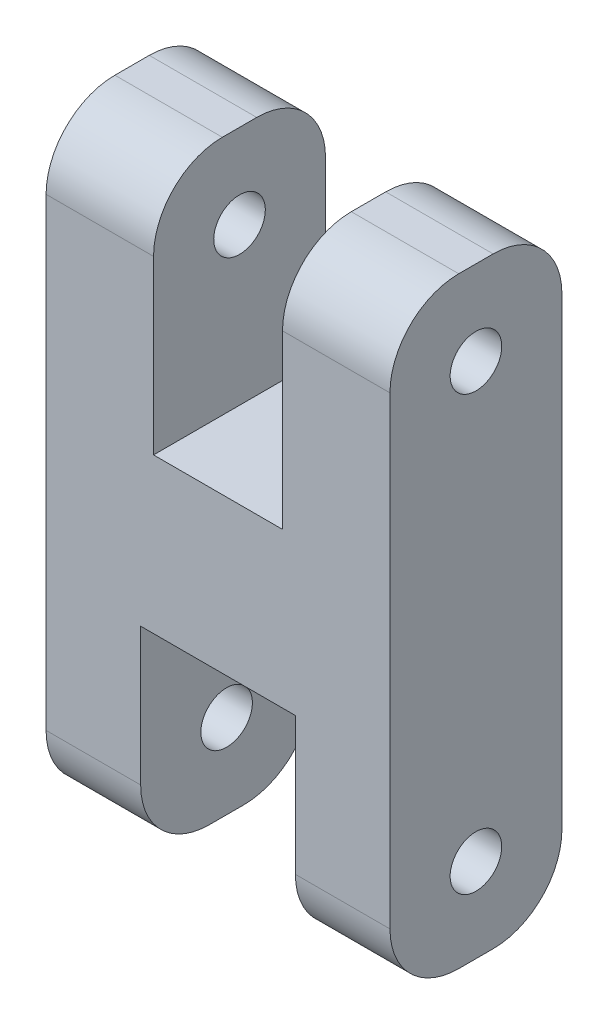
from build123d import *

# Parameters (mm, degrees)
CROQUIS1_R                 = 1.5
SALIENTE_EXTRUIR1_DEPTH    = 10
CORTAR_EXTRUIR1_DEPTH      = 21.766559657
CORTAR_EXTRUIR1_DEPTH_BACK = 21.766559657
CROQUIS2_W                 = 9
CROQUIS2_H                 = 12
CROQUIS2_W_2               = 7.5
CROQUIS2_H_2               = 14


with BuildPart() as part:
    # Croquis1 → Saliente-Extruir1 (new, symmetric)
    with BuildSketch(Plane(origin=(0, 0, 0), x_dir=(0, 0, -1), z_dir=(1, 0, 0))):
        with BuildLine():
            Line((-1, 17.5), (1, 17.5))
            ThreePointArc((1, 17.5), (3.828427125, 16.328427125), (5, 13.5))
            Line((5, 13.5), (5, -13.5))
            ThreePointArc((5, -13.5), (3.828427125, -16.328427125), (1, -17.5))
            Line((1, -17.5), (-1, -17.5))
            ThreePointArc((-1, -17.5), (-3.828427125, -16.328427125), (-5, -13.5))
            Line((-5, -13.5), (-5, 13.5))
            ThreePointArc((-5, 13.5), (-3.828427125, 16.328427125), (-1, 17.5))
        make_face()
        with Locations((0, 12.6)):
            Circle(CROQUIS1_R, mode=Mode.SUBTRACT)
        with Locations((0, -12.6)):
            Circle(CROQUIS1_R, mode=Mode.SUBTRACT)
    extrude(amount=SALIENTE_EXTRUIR1_DEPTH, both=True)

    # Croquis2 → Cortar-Extruir1 (cut, two sides: drawn at the far end of the back side and taken through both)
    with BuildSketch(Plane.XY.offset(-CORTAR_EXTRUIR1_DEPTH_BACK)):
        with Locations((0, -11.5)):
            Rectangle(CROQUIS2_W, CROQUIS2_H)
        with Locations((0, 10.5)):
            Rectangle(CROQUIS2_W_2, CROQUIS2_H_2)
    extrude(amount=CORTAR_EXTRUIR1_DEPTH + CORTAR_EXTRUIR1_DEPTH_BACK, mode=Mode.SUBTRACT)


solid = part.part
